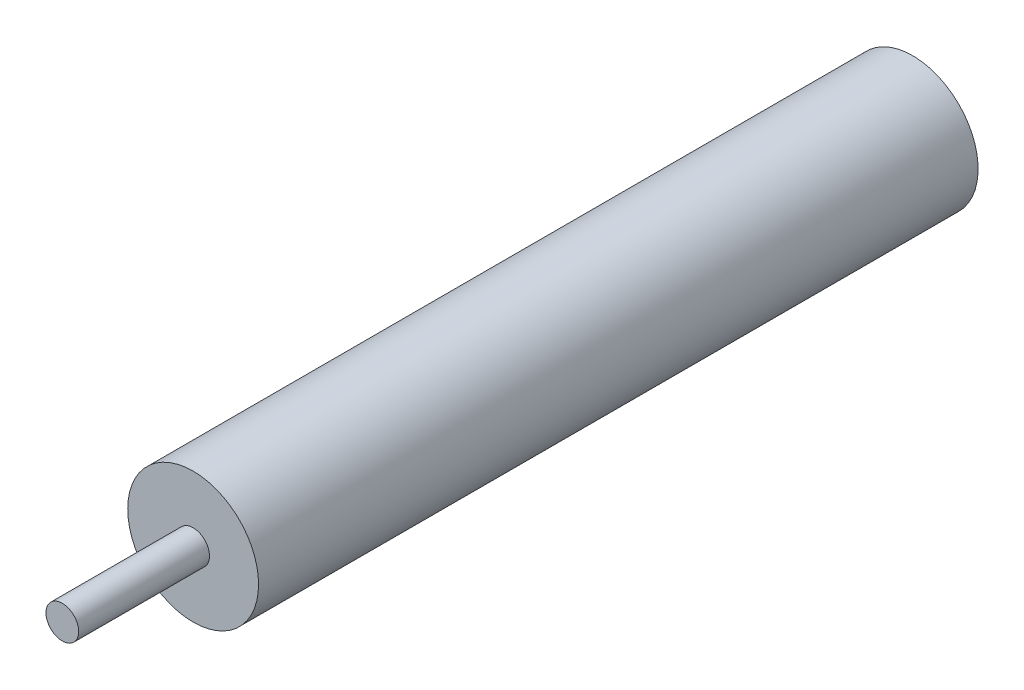
from build123d import *

# Parameters (mm, degrees)
SKETCH2_R           = 10
BOSS_EXTRUDE1_DEPTH = 95
BOSS_EXTRUDE2_START = 15
SKETCH3_R           = 10
BOSS_EXTRUDE2_DEPTH = 15
SKETCH5_R           = 2.5
BOSS_EXTRUDE3_DEPTH = 20


with BuildPart() as part:
    # Sketch2 → Boss-Extrude1 (new body)
    with BuildSketch(Plane.XY):
        Circle(SKETCH2_R)
    extrude(amount=BOSS_EXTRUDE1_DEPTH)

    # Sketch3 → Boss-Extrude2 (add)
    with BuildSketch(Plane(origin=(0, 0, 0), x_dir=(-1, 0, 0), z_dir=(0, 0, -1)).offset(BOSS_EXTRUDE2_START)):
        Circle(SKETCH3_R)
    extrude(amount=-BOSS_EXTRUDE2_DEPTH)

    # Sketch5 → Boss-Extrude3 (add)
    with BuildSketch(Plane.XY.offset(95)):
        Circle(SKETCH5_R)
    extrude(amount=BOSS_EXTRUDE3_DEPTH)


solid = part.part
